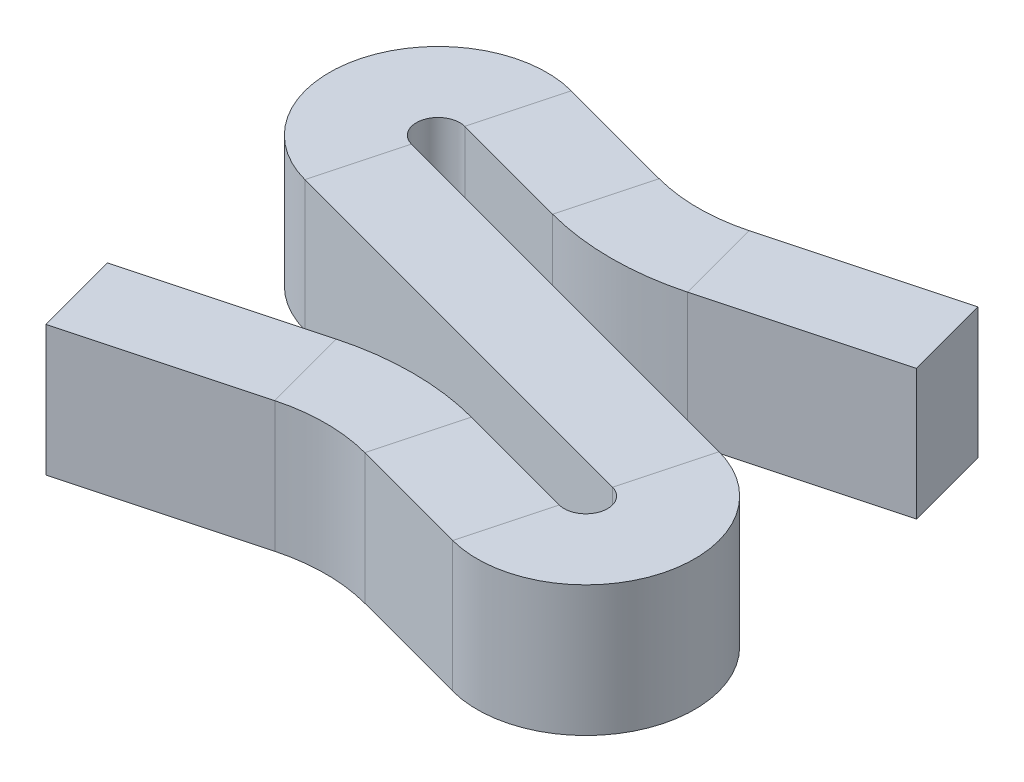
from build123d import *

# Parameters (mm, degrees)
SKETCH2_W = 2
SKETCH2_H = 3


with BuildPart() as part:
    # Sweep1: sweep along a path in Sketch1
    with BuildLine(Plane(origin=(0, 0, 0), x_dir=(1, 0, 0), z_dir=(0, 1, 0))) as sweep1_path:
        Line((5.441400564, 4.563847428), (1.294095226, 3.452580312))
        ThreePointArc((1.294095226, 3.452580312), (0, 3.282209443), (-1.294095226, 3.452580312))
        Line((-1.294095226, 3.452580312), (-4.053171996, 4.191872704))
        ThreePointArc((-4.053171996, 4.191872704), (-5.890289303, 3.131212533), (-4.829629131, 1.294095226))
        Line((-4.829629131, 1.294095226), (4.829629131, -1.294095226))
        ThreePointArc((4.829629131, -1.294095226), (5.890289303, -3.131212533), (4.053171996, -4.191872704))
        Line((4.053171996, -4.191872704), (1.294095226, -3.452580312))
        ThreePointArc((1.294095226, -3.452580312), (0, -3.282209443), (-1.294095226, -3.452580312))
        Line((-1.294095226, -3.452580312), (-5.441400564, -4.563847428))
    # Sketch2 → Sweep1 (sweep)
    with BuildSketch(Plane(origin=(-5.441400564, 0, 4.563847428), x_dir=(0.2588190451025149, 0, 0.96592582628907), z_dir=(-0.96592582628907, 0, 0.2588190451025149))):
        Rectangle(SKETCH2_W, SKETCH2_H)
    sweep(path=sweep1_path.line)


solid = part.part
